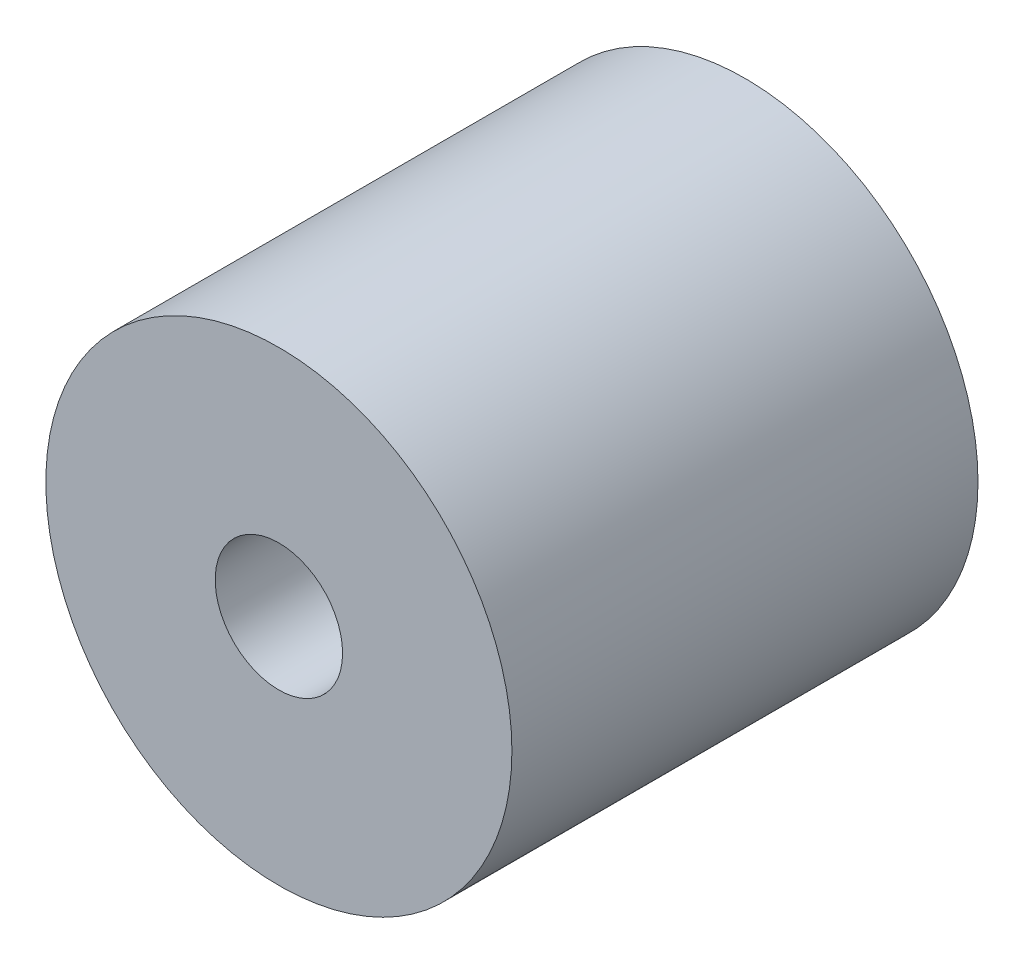
from build123d import *

# Parameters (mm, degrees)
SKETCH_2_R      = 15
SKETCH_2_R_2    = 4.1
EXTRUDE_1_DEPTH = 30


with BuildPart() as part:
    # ｽｹｯﾁ2 → ﾎﾞｽ - 押し出し1 (new body)
    with BuildSketch(Plane.XY):
        Circle(SKETCH_2_R)
        Circle(SKETCH_2_R_2, mode=Mode.SUBTRACT)
    extrude(amount=EXTRUDE_1_DEPTH)


solid = part.part
